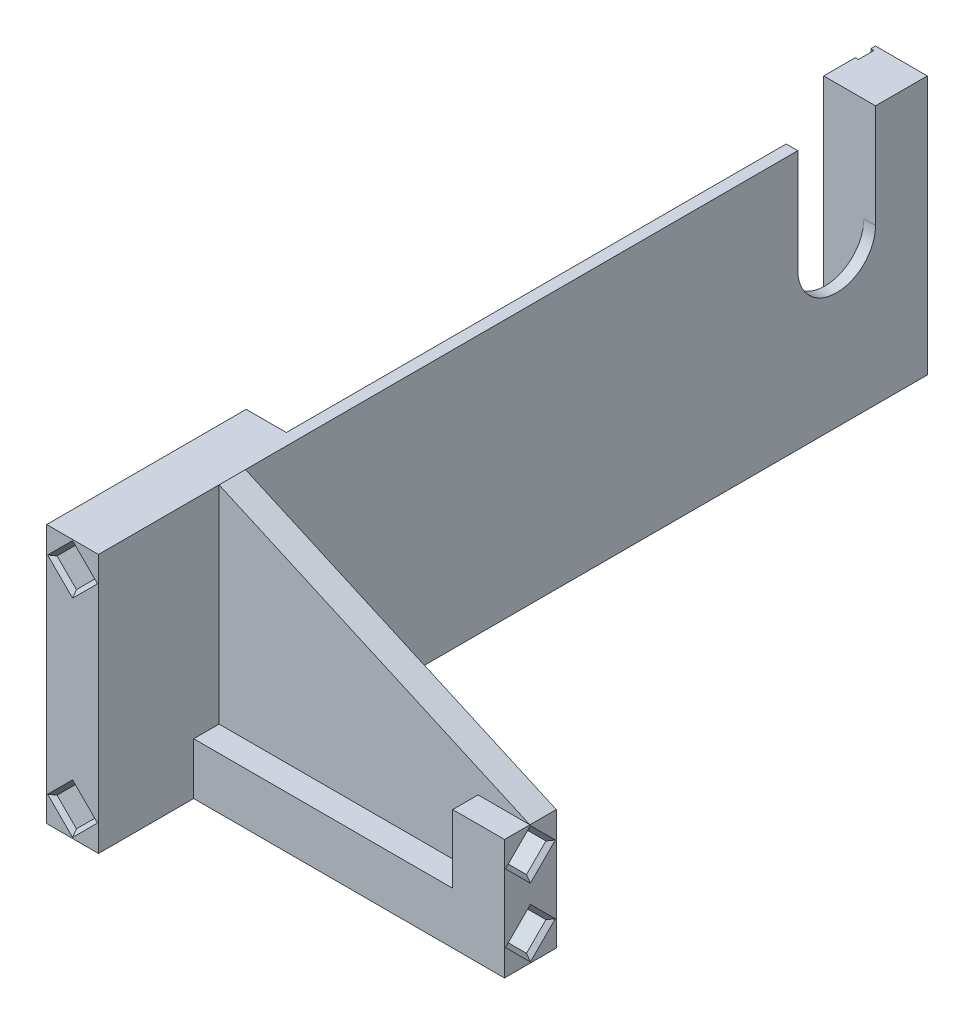
from build123d import *

# Parameters (mm, degrees)
BOSS_EXTRUDE2_DEPTH             = 8.466666667
BOSS_EXTRUDE4_DEPTH             = 3.175
F_24_0_152_DIAMETER_HOLE1_D     = 3.8608
F_24_0_152_DIAMETER_HOLE1_DEPTH = 3.175
BOSS_EXTRUDE5_DEPTH             = 33.866666667
SKETCH19_W                      = 8.466666666
SKETCH19_H                      = 8.466666667
BOSS_EXTRUDE7_DEPTH             = 11.141667582
BOSS_EXTRUDE6_DEPTH             = 4.318
RIGHTPINS_DEPTH                 = 6.35
LEFTPINS_DEPTH                  = 6.35
FRONTPINS_DEPTH                 = 6.35
PINCHAMFER_SIZE                 = 0.635
CUT_EXTRUDE1_REACH              = 109.894
CUT_EXTRUDE2_REACH              = 104.372
SKETCH21_W                      = 0.508
SKETCH21_H                      = 2.54


with BuildPart() as part:
    # Sketch3 → Boss-Extrude2 (new body)
    with BuildSketch(Plane(origin=(0, 0, 0), x_dir=(1, 0, 0), z_dir=(0, 1, 0))):
        Polygon((-29.210008467, 50.211675347), (-37.676675133, 50.211675347), (-37.676675133, -85.254991405), (-29.210008467, -85.254991405), (-29.210008467, -69.696666667), (21.589991533, -69.696666667), (21.589991533, -61.23), (-29.210008467, -61.23), align=None)
    extrude(amount=BOSS_EXTRUDE2_DEPTH)

    # Sketch12 → Boss-Extrude4 (add)
    with BuildSketch(Plane(origin=(0, 0, 0), x_dir=(1, 0, 0), z_dir=(0, 1, 0))):
        with BuildLine():
            Line((-25.75, -51.77), (-29.210008467, -51.77))
            Line((-29.210008467, -51.77), (-29.210008467, -61.23))
            Line((-29.210008467, -61.23), (-25.75, -61.23))
            ThreePointArc((-25.75, -61.23), (-21.02, -56.5), (-25.75, -51.77))
        make_face()
    extrude(amount=BOSS_EXTRUDE4_DEPTH)

    # #24 (0.152) Diameter Hole1
    with Locations(Plane(origin=(0, 3.175, 0), x_dir=(1, 0, 0), z_dir=(0, 1, 0))):
        with Locations((-25.75, 56.5), (-25.75, -56.5)):
            Hole(F_24_0_152_DIAMETER_HOLE1_D / 2, depth=F_24_0_152_DIAMETER_HOLE1_DEPTH)

    # Sketch16 → Boss-Extrude5 (add)
    with BuildSketch(Plane(origin=(0, 8.466666667, 0), x_dir=(1, 0, 0), z_dir=(0, 1, 0))):
        Polygon((-37.676675133, -85.254991405), (-37.676675133, -52.64717283), (-31.115008467, -52.64717283), (-31.115008467, 41.74500868), (-37.676675133, 41.74500868), (-37.676675133, 50.211675347), (-29.210008467, 50.211675347), (-29.210008467, -85.254991405), align=None)
    extrude(amount=BOSS_EXTRUDE5_DEPTH)

    # Sketch19 → Boss-Extrude7 (add)
    with BuildSketch(Plane(origin=(0, 8.466666667, 0), x_dir=(1, 0, 0), z_dir=(0, 1, 0))):
        with Locations((17.3566582, -65.463333334)):
            Rectangle(SKETCH19_W, SKETCH19_H)
    extrude(amount=BOSS_EXTRUDE7_DEPTH)

    # Sketch18 → Boss-Extrude6 (add)
    with BuildSketch(Plane(origin=(0, 0, 61.23), x_dir=(-1, 0, 0), z_dir=(0, 0, -1))):
        Polygon((-21.589991533, 19.608334249), (29.210008467, 42.333333333), (29.210008467, 8.466666667), (-13.123324867, 8.466666667), (-13.123324867, 19.608334249), align=None)
    extrude(amount=-BOSS_EXTRUDE6_DEPTH)

    # Sketch4 → RightPins (cut)
    with BuildSketch(Plane.XY.offset(85.254991405)):
        Polygon((-36.6183418, 4.233333333), (-33.4433418, 7.408333333), (-30.2683418, 4.233333333), (-33.4433418, 1.058333333), align=None)
        Polygon((-36.6183418, 38.1), (-33.4433418, 41.275), (-30.2683418, 38.1), (-33.4433418, 34.925), align=None)
    extrude(amount=-RIGHTPINS_DEPTH, mode=Mode.SUBTRACT)

    # Sketch5 → LeftPins (cut)
    with BuildSketch(Plane(origin=(0, 0, -50.211675347), x_dir=(-1, 0, 0), z_dir=(0, 0, -1))):
        Polygon((30.2683418, 4.233333333), (33.4433418, 7.408333333), (36.6183418, 4.233333333), (33.4433418, 1.058333333), align=None)
        Polygon((30.2683418, 38.1), (33.4433418, 41.275), (36.6183418, 38.1), (33.4433418, 34.925), align=None)
    extrude(amount=-LEFTPINS_DEPTH, mode=Mode.SUBTRACT)

    # Sketch11 → FrontPins (cut)
    with BuildSketch(Plane(origin=(21.589991533, 0, 0), x_dir=(0, 0, -1), z_dir=(1, 0, 0))):
        Polygon((-68.638333333, 4.233333333), (-65.463333333, 7.408333333), (-62.288333333, 4.233333333), (-65.463333333, 1.058333333), align=None)
        Polygon((-68.638333333, 15.375000915), (-65.463333333, 18.550000915), (-62.288333333, 15.375000915), (-65.463333333, 12.200000915), align=None)
    extrude(amount=-FRONTPINS_DEPTH, mode=Mode.SUBTRACT)

    # PinChamfer
    pinchamfer_edges = [part.edges().sort_by_distance(p)[0] for p in [
        (-35.0308418, 2.645833333, 78.904991405),
        (-35.0308418, 5.820833333, 78.904991405),
        (-31.8558418, 5.820833333, 78.904991405),
        (-31.8558418, 2.645833333, 78.904991405),
        (-35.0308418, 2.645833333, 85.254991405),
        (-31.8558418, 2.645833333, 85.254991405),
        (-31.8558418, 5.820833333, 85.254991405),
        (-35.0308418, 5.820833333, 85.254991405),
        (-35.0308418, 36.5125, 78.904991405),
        (-35.0308418, 39.6875, 78.904991405),
        (-31.8558418, 39.6875, 78.904991405),
        (-31.8558418, 36.5125, 78.904991405),
        (-35.0308418, 36.5125, 85.254991405),
        (-31.8558418, 36.5125, 85.254991405),
        (-31.8558418, 39.6875, 85.254991405),
        (-35.0308418, 39.6875, 85.254991405),
        (-31.8558418, 2.645833333, -43.861675347),
        (-31.8558418, 5.820833333, -43.861675347),
        (-35.0308418, 5.820833333, -43.861675347),
        (-35.0308418, 2.645833333, -43.861675347),
        (-31.8558418, 2.645833333, -50.211675347),
        (-35.0308418, 2.645833333, -50.211675347),
        (-35.0308418, 5.820833333, -50.211675347),
        (-31.8558418, 5.820833333, -50.211675347),
        (-31.8558418, 36.5125, -43.861675347),
        (-31.8558418, 39.6875, -43.861675347),
        (-35.0308418, 39.6875, -43.861675347),
        (-35.0308418, 36.5125, -43.861675347),
        (-31.8558418, 36.5125, -50.211675347),
        (-35.0308418, 36.5125, -50.211675347),
        (-35.0308418, 39.6875, -50.211675347),
        (-31.8558418, 39.6875, -50.211675347),
        (15.239991533, 2.645833333, 67.050833333),
        (15.239991533, 5.820833333, 67.050833333),
        (15.239991533, 5.820833333, 63.875833333),
        (15.239991533, 2.645833333, 63.875833333),
        (21.589991533, 2.645833333, 67.050833333),
        (21.589991533, 2.645833333, 63.875833333),
        (21.589991533, 5.820833333, 63.875833333),
        (21.589991533, 5.820833333, 67.050833333),
        (15.239991533, 13.787500915, 67.050833333),
        (15.239991533, 16.962500915, 67.050833333),
        (15.239991533, 16.962500915, 63.875833333),
        (15.239991533, 13.787500915, 63.875833333),
        (21.589991533, 13.787500915, 67.050833333),
        (21.589991533, 13.787500915, 63.875833333),
        (21.589991533, 16.962500915, 63.875833333),
        (21.589991533, 16.962500915, 67.050833333),
    ]]
    chamfer(pinchamfer_edges, length=PINCHAMFER_SIZE)

    # Sketch20 → Cut-Extrude1 (cut, up to next)
    with BuildSketch(Plane(origin=(-29.210008467, 0, 0), x_dir=(0, 0, -1), z_dir=(1, 0, 0)), mode=Mode.PRIVATE) as cut_extrude1_sk1:
        with BuildLine():
            Line((41.74500868, 25.4), (41.74500868, 42.333333333))
            Line((41.74500868, 42.333333333), (29.04500868, 42.333333333))
            Line((29.04500868, 42.333333333), (29.04500868, 25.4))
            ThreePointArc((29.04500868, 25.4), (35.39500868, 19.05), (41.74500868, 25.4))
        make_face()
    cut_extrude1_tool1 = extrude(cut_extrude1_sk1.sketch, amount=-CUT_EXTRUDE1_REACH, mode=Mode.PRIVATE) & part.part
    add(cut_extrude1_tool1.solids().sort_by_distance((-29.210008, 31.327209, -35.395009))[0], mode=Mode.SUBTRACT)

    # Sketch21 → Cut-Extrude2 (cut, up to next)
    with BuildSketch(Plane(origin=(0, 42.333333333, 0), x_dir=(1, 0, 0), z_dir=(0, 1, 0)), mode=Mode.PRIVATE) as cut_extrude2_sk1:
        with Locations((-37.422675133, 48.179675347)):
            Rectangle(SKETCH21_W, SKETCH21_H)
    cut_extrude2_tool1 = extrude(cut_extrude2_sk1.sketch, amount=-CUT_EXTRUDE2_REACH, mode=Mode.PRIVATE) & part.part
    add(cut_extrude2_tool1.solids().sort_by_distance((-37.422675, 42.333333, -48.179675))[0], mode=Mode.SUBTRACT)


solid = part.part
